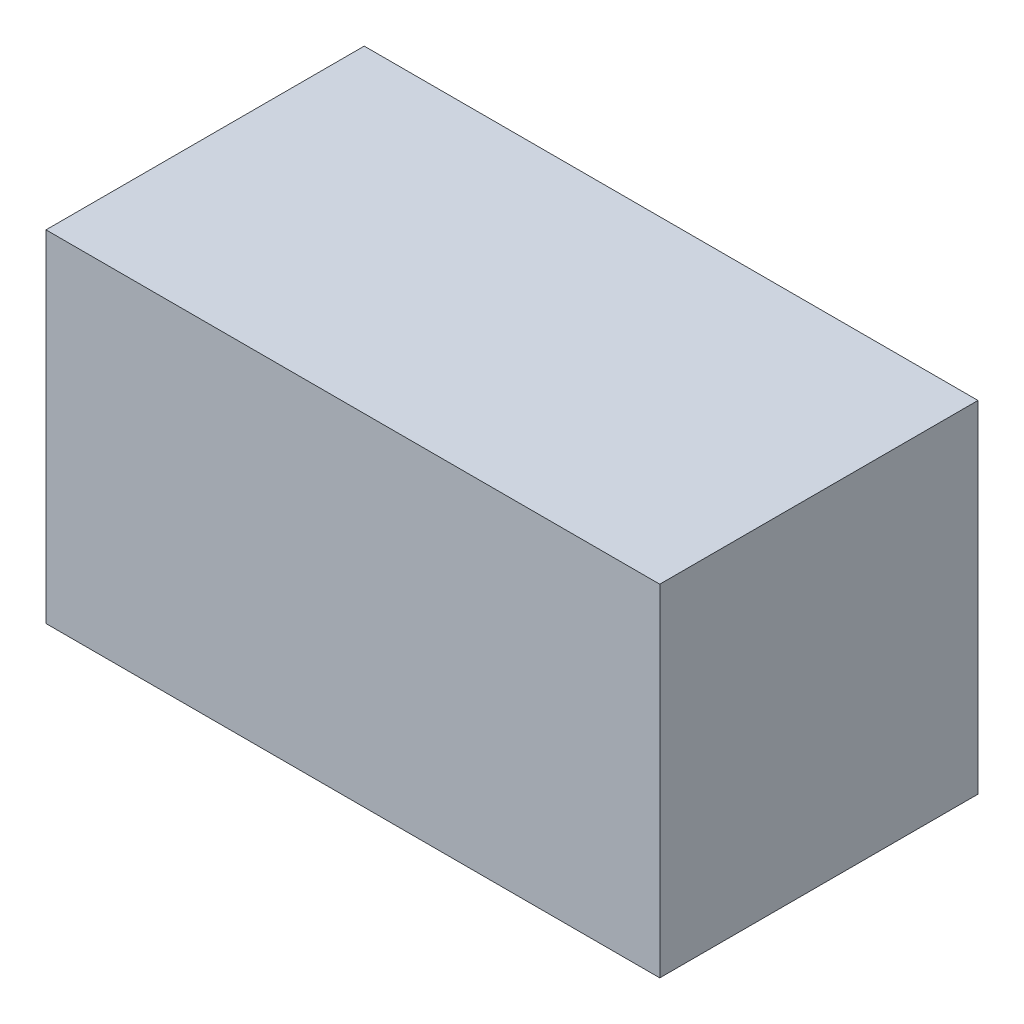
from build123d import *

# Parameters (mm, degrees)
MASTER_FOOTPRINT_W    = 1350
MASTER_FOOTPRINT_H    = 700
BATH_BASE_PLATE_DEPTH = 750


with BuildPart() as part:
    # MASTER_FOOTPRINT → BATH_BASE_PLATE (new body)
    with BuildSketch(Plane(origin=(0, 0, 0), x_dir=(1, 0, 0), z_dir=(0, 1, 0))):
        with Locations((675, 350)):
            Rectangle(MASTER_FOOTPRINT_W, MASTER_FOOTPRINT_H)
    extrude(amount=BATH_BASE_PLATE_DEPTH)


solid = part.part
